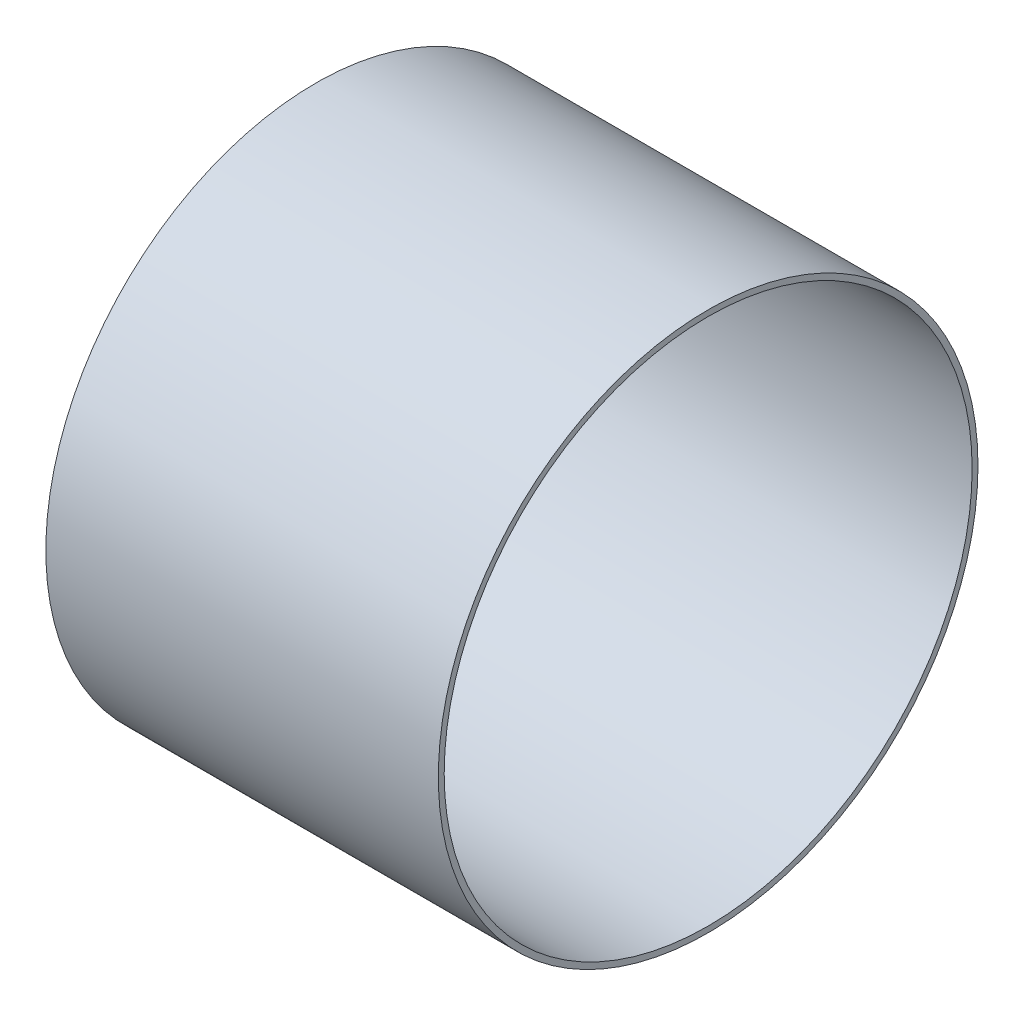
from build123d import *

# Parameters (mm, degrees)
SKETCH1_R           = 69.85
SKETCH1_R_2         = 68.33108
BOSS_EXTRUDE1_DEPTH = 101.6


with BuildPart() as part:
    # Sketch1 → Boss-Extrude1 (new body)
    with BuildSketch(Plane(origin=(0, 0, 0), x_dir=(0, 0, -1), z_dir=(1, 0, 0))):
        Circle(SKETCH1_R)
        Circle(SKETCH1_R_2, mode=Mode.SUBTRACT)
    extrude(amount=BOSS_EXTRUDE1_DEPTH)


solid = part.part
